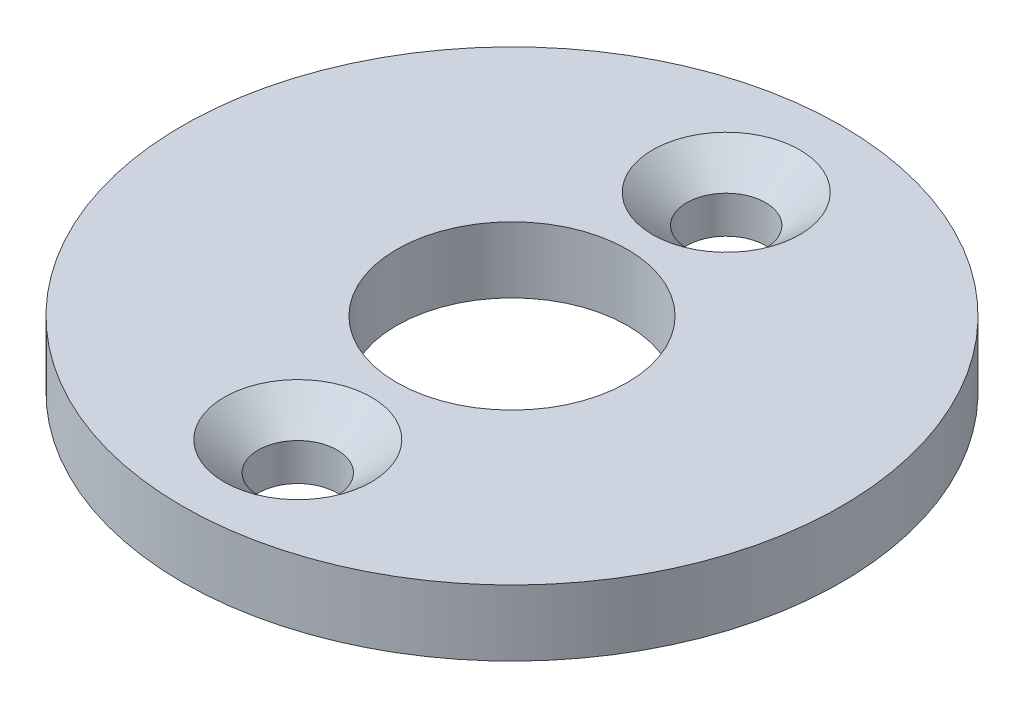
from build123d import *

# Parameters (mm, degrees)
SKETCH1_R                                         = 15.875
SKETCH1_R_2                                       = 5.55625
BOSS_EXTRUDE1_DEPTH                               = 3.175
CSK_FOR_6_FLAT_HEAD_MACHINE_SCREW_100_D           = 3.7973
CSK_FOR_6_FLAT_HEAD_MACHINE_SCREW_100_CSINK_D     = 7.0866
CSK_FOR_6_FLAT_HEAD_MACHINE_SCREW_100_CSINK_ANGLE = 100


with BuildPart() as part:
    # Sketch1 → Boss-Extrude1 (new body)
    with BuildSketch(Plane(origin=(0, 0, 0), x_dir=(1, 0, 0), z_dir=(0, 1, 0))):
        with Locations(Location((0, 0, 0), (0, 0, 270))):
            Circle(SKETCH1_R)
        with Locations(Location((0, 0, 0), (0, 0, 270))):
            Circle(SKETCH1_R_2, mode=Mode.SUBTRACT)
    extrude(amount=BOSS_EXTRUDE1_DEPTH)

    # CSK for #6 Flat Head Machine Screw (100)1 (through all)
    with Locations(Plane(origin=(0, 3.175, 0), x_dir=(1, 0, 0), z_dir=(0, 1, 0))):
        with Locations((0, -10.31875), (0, 10.31875)):
            CounterSinkHole(CSK_FOR_6_FLAT_HEAD_MACHINE_SCREW_100_D / 2, CSK_FOR_6_FLAT_HEAD_MACHINE_SCREW_100_CSINK_D / 2, counter_sink_angle=CSK_FOR_6_FLAT_HEAD_MACHINE_SCREW_100_CSINK_ANGLE)


solid = part.part
